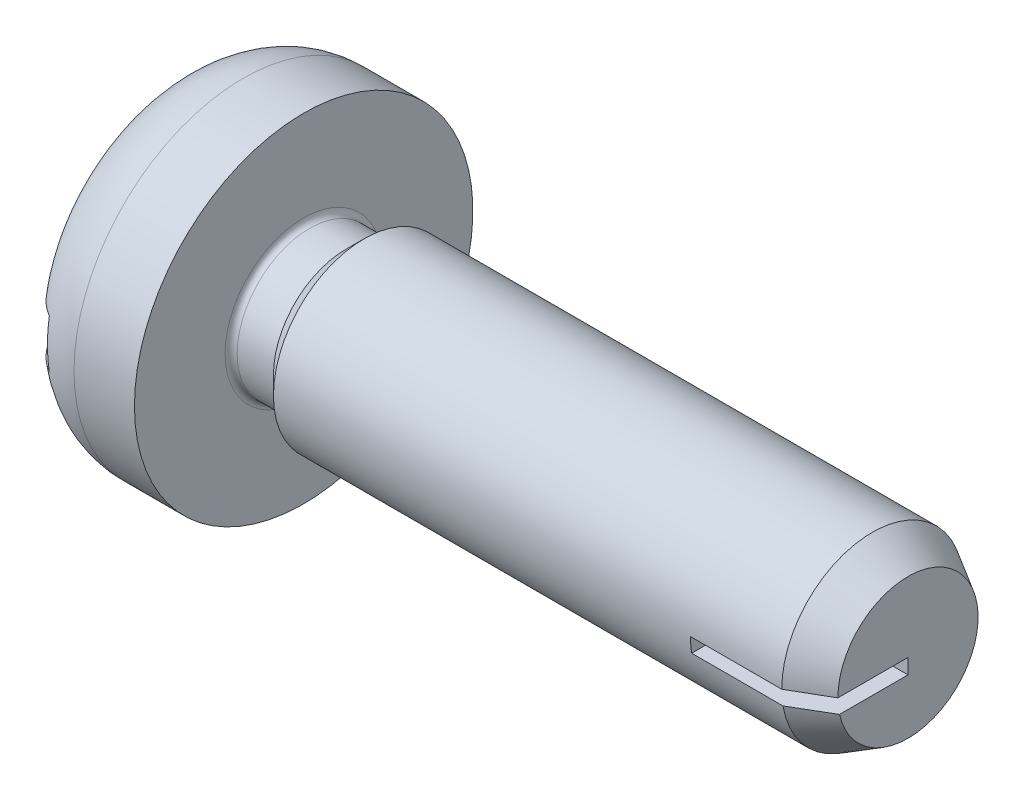
from build123d import *

# Parameters (mm, degrees)
SLOT_CUT_EXTRUDE1_DEPTH      = 13.826535018
SLOT_CUT_EXTRUDE1_DEPTH_BACK = 13.826535018
SKETCH2_W                    = 0.6
SKETCH2_H                    = 0.8
SKETCH11_W                   = 2.1
SKETCH11_H                   = 0.25
POINT_CUT_EXTRUDE8_DEPTH     = 13.82653504


with BuildPart() as part:
    # Sketch1 → base-Revolve (revolve)
    with BuildSketch(Plane.XY, mode=Mode.PRIVATE) as base_revolve_sk:
        with BuildLine():
            Line((0, 0), (0, 1.6))
            ThreePointArc((0, 1.6), (0.351471863, 2.448528137), (1.2, 2.8))
            Line((1.2, 2.8), (2.2, 2.8))
            Line((2.2, 2.8), (2.2, 1.3))
            ThreePointArc((2.2, 1.3), (2.229289322, 1.229289322), (2.3, 1.2))
            Line((2.3, 1.2), (2.9, 1.2))
            Line((2.9, 1.2), (3.2, 1.5))
            Line((3.2, 1.5), (12.2, 1.5))
            Line((12.2, 1.5), (12.2, 0))
            Line((12.2, 0), (0, 0))
        make_face()
    revolve(base_revolve_sk.sketch.rotate(Axis((0, 0, 0), (1, 0, 0)), 90), axis=Axis((0, 0, 0), (1, 0, 0)))

    # Sketch2 → slot_Cut-Extrude1 (cut, two sides: drawn at the far end of the back side and taken through both)
    with BuildSketch(Plane.XY.offset(-SLOT_CUT_EXTRUDE1_DEPTH_BACK)):
        with Locations((0.3, 0)):
            Rectangle(SKETCH2_W, SKETCH2_H)
    extrude(amount=SLOT_CUT_EXTRUDE1_DEPTH + SLOT_CUT_EXTRUDE1_DEPTH_BACK, mode=Mode.SUBTRACT)

    # Sketch8 → point_Cut-Revolve1 (revolve, cut)
    with BuildSketch(Plane.XY, mode=Mode.PRIVATE) as point_cut_revolve1_sk:
        Polygon((12.2, 0), (12.708, 0), (12.708, 2.008), (11.611102725, 2.008), (11.611102725, 1.5), (12.2, 1.16), align=None)
    revolve(point_cut_revolve1_sk.sketch.rotate(Axis((0, 0, 0), (1, 0, 0)), 90), axis=Axis((0, 0, 0), (1, 0, 0)), mode=Mode.SUBTRACT)

    # Sketch11 → point_Cut-Extrude8 (cut, through all)
    with BuildSketch(Plane.XY):
        with Locations((11.15, -0.125)):
            Rectangle(SKETCH11_W, SKETCH11_H)
    extrude(amount=POINT_CUT_EXTRUDE8_DEPTH, mode=Mode.SUBTRACT)


solid = part.part
